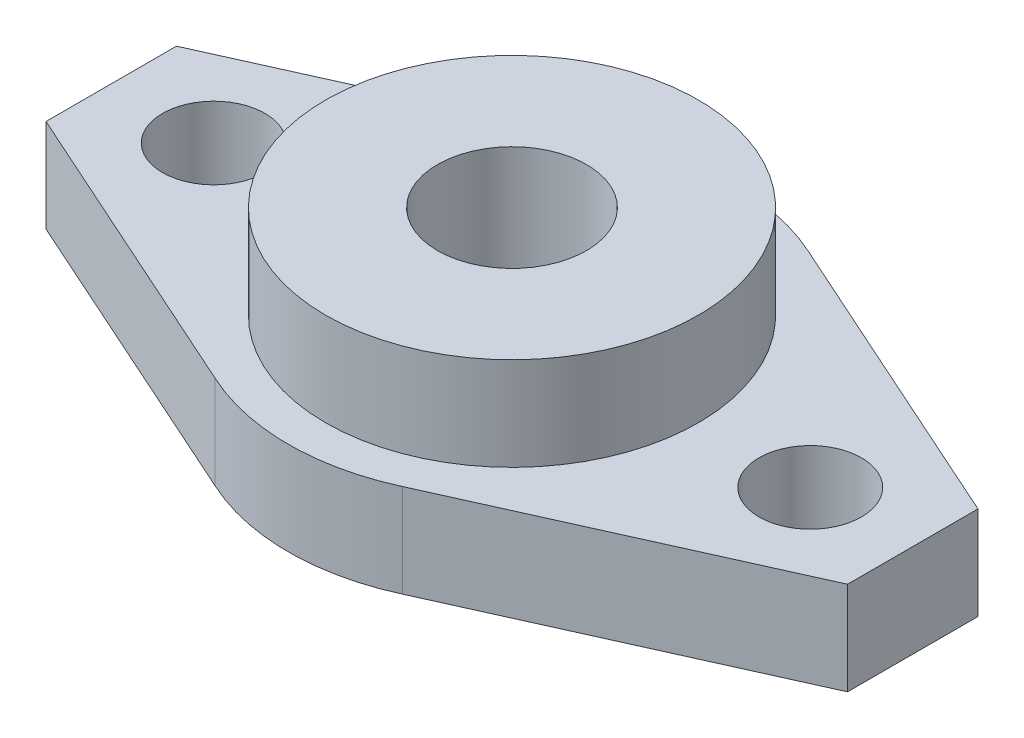
from build123d import *

# Parameters (mm, degrees)
SKETCH1_R           = 2.75
SKETCH1_R_2         = 12
BOSS_EXTRUDE1_DEPTH = 5
SKETCH2_R           = 10
BOSS_EXTRUDE2_DEPTH = 5
CUT_EXTRUDE1_REACH  = 28.575
SKETCH3_R           = 4


with BuildPart() as part:
    # Sketch1 → Boss-Extrude1 (new body)
    # profile 1 of 3: a face of its own
    with BuildSketch(Plane(origin=(0, 0, 0), x_dir=(1, 0, 0), z_dir=(0, 1, 0))):
        with BuildLine():
            Line((21.5, 3.5), (5.025448323, 10.897011937))
            ThreePointArc((5.025448323, 10.897011937), (10.10706139, 6.468949688), (12, 0))
            ThreePointArc((12, 0), (10.10706139, -6.468949688), (5.025448323, -10.897011937))
            Line((5.025448323, -10.897011937), (21.5, -3.5))
            Line((21.5, -3.5), (21.5, 3.5))
        make_face()
        with Locations(Location((16, 0, 0), (0, 0, 270))):
            Circle(SKETCH1_R, mode=Mode.SUBTRACT)
    # profile 2 of 3: a face of its own
    with BuildSketch(Plane(origin=(0, 0, 0), x_dir=(1, 0, 0), z_dir=(0, 1, 0))):
        Circle(SKETCH1_R_2)
    # profile 3 of 3: a face of its own
    with BuildSketch(Plane(origin=(0, 0, 0), x_dir=(1, 0, 0), z_dir=(0, 1, 0))):
        with BuildLine():
            Line((-5.025448323, 10.897011937), (-21.5, 3.5))
            Line((-21.5, 3.5), (-21.5, -3.5))
            Line((-21.5, -3.5), (-5.025448323, -10.897011937))
            ThreePointArc((-5.025448323, -10.897011937), (-12, 0), (-5.025448323, 10.897011937))
        make_face()
        with Locations(Location((-16, 0, 0), (0, 0, 270))):
            Circle(SKETCH1_R, mode=Mode.SUBTRACT)
    extrude(amount=BOSS_EXTRUDE1_DEPTH)

    # Sketch2 → Boss-Extrude2 (add)
    with BuildSketch(Plane(origin=(0, 5, 0), x_dir=(1, 0, 0), z_dir=(0, 1, 0))):
        with Locations(Location((0, 0, 0), (0, 0, 270))):
            Circle(SKETCH2_R)
    extrude(amount=BOSS_EXTRUDE2_DEPTH)

    # Sketch3 → Cut-Extrude1 (cut, up to next)
    with BuildSketch(Plane(origin=(0, 10, 0), x_dir=(1, 0, 0), z_dir=(0, 1, 0)), mode=Mode.PRIVATE) as cut_extrude1_sk1:
        with Locations(Location((0, 0, 0), (0, 0, 270))):
            Circle(SKETCH3_R)
    cut_extrude1_tool1 = extrude(cut_extrude1_sk1.sketch, amount=-CUT_EXTRUDE1_REACH, mode=Mode.PRIVATE) & part.part
    add(cut_extrude1_tool1.solids().sort_by_distance((0, 10, 0))[0], mode=Mode.SUBTRACT)


solid = part.part
